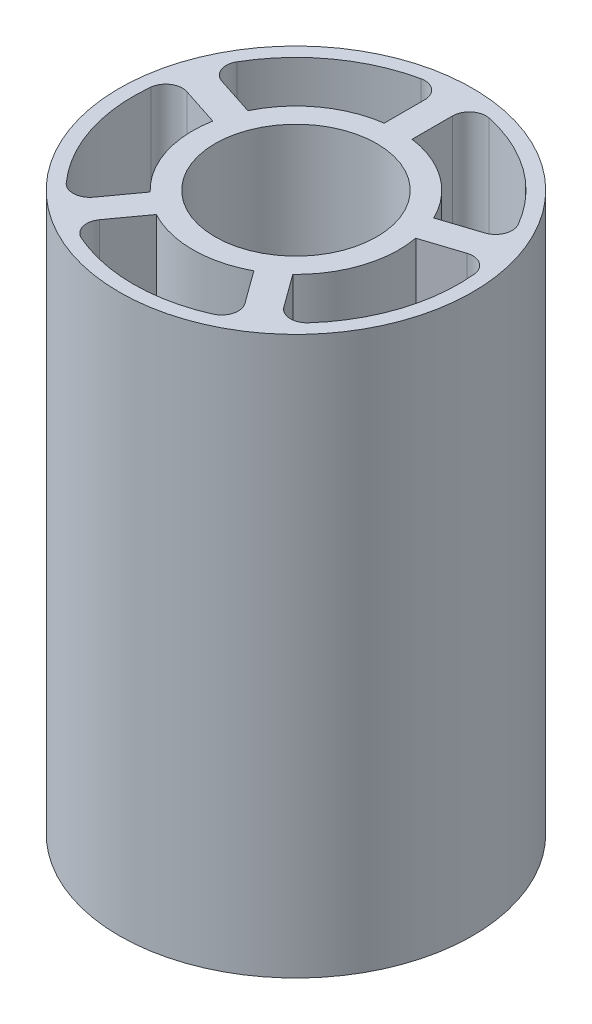
from build123d import *

# Parameters (mm, degrees)
SKETCH1_R           = 31.685
SKETCH1_R_2         = 14.5
BOSS_EXTRUDE1_DEPTH = 100


with BuildPart() as part:
    # Sketch1 → Boss-Extrude1 (new body)
    with BuildSketch(Plane(origin=(0, 0, 0), x_dir=(1, 0, 0), z_dir=(0, 1, 0))):
        with Locations(Location((0, 0, 0), (0, 0, 270))):
            Circle(SKETCH1_R)
        with Locations(Location((0, 0, 0), (0, 0, 270))):
            Circle(SKETCH1_R_2, mode=Mode.SUBTRACT)
        with BuildLine():
            Line((23.575325811, 10.288743262), (16.660611418, 8.042016362))
            ThreePointArc((16.660611418, 8.042016362), (10.874027167, 14.966814396), (2.5, 18.33030278))
            Line((2.5, 18.33030278), (2.5, 25.600863755))
            ThreePointArc((2.5, 25.600863755), (3.614581646, 27.93435848), (6.130131755, 28.53393961))
            ThreePointArc((6.130131755, 28.53393961), (17.154512588, 23.611160981), (25.243074312, 14.647574007))
            ThreePointArc((25.243074312, 14.647574007), (25.450186505, 12.069862926), (23.575325811, 10.288743262))
        make_face(mode=Mode.SUBTRACT)
        with BuildLine():
            Line((-2.5, 25.600863755), (-2.5, 18.33030278))
            ThreePointArc((-2.5, 18.33030278), (-10.874027167, 14.966814396), (-16.660611418, 8.042016362))
            Line((-16.660611418, 8.042016362), (-23.575325811, 10.288743262))
            ThreePointArc((-23.575325811, 10.288743262), (-25.450186505, 12.069862926), (-25.243074312, 14.647574007))
            ThreePointArc((-25.243074312, 14.647574007), (-17.154512588, 23.611160981), (-6.130131755, 28.53393961))
            ThreePointArc((-6.130131755, 28.53393961), (-3.614581646, 27.93435848), (-2.5, 25.600863755))
        make_face(mode=Mode.SUBTRACT)
        with BuildLine():
            Line((25.120410783, 5.53346068), (18.20569639, 3.28673378))
            ThreePointArc((18.20569639, 3.28673378), (17.594545551, -5.716814396), (12.79682413, -13.36006333))
            Line((12.79682413, -13.36006333), (17.070352647, -19.242070718))
            ThreePointArc((17.070352647, -19.242070718), (19.343661926, -20.474772952), (21.73120966, -19.481241021))
            ThreePointArc((21.73120966, -19.481241021), (27.756584428, -9.018660981), (29.031704092, 2.987370505))
            ThreePointArc((29.031704092, 2.987370505), (27.684120817, 5.194520069), (25.120410783, 5.53346068))
        make_face(mode=Mode.SUBTRACT)
        with BuildLine():
            Line((13.025267675, -22.180996979), (8.751739158, -16.298989592))
            ThreePointArc((8.751739158, -16.298989592), (0, -18.5), (-8.751739158, -16.298989592))
            Line((-8.751739158, -16.298989592), (-13.025267675, -22.180996979))
            ThreePointArc((-13.025267675, -22.180996979), (-13.495145967, -24.723968522), (-11.812448125, -26.687643101))
            ThreePointArc((-11.812448125, -26.687643101), (0, -29.185), (11.812448125, -26.687643101))
            ThreePointArc((11.812448125, -26.687643101), (13.495145967, -24.723968522), (13.025267675, -22.180996979))
        make_face(mode=Mode.SUBTRACT)
        with BuildLine():
            Line((-17.070352647, -19.242070718), (-12.79682413, -13.36006333))
            ThreePointArc((-12.79682413, -13.36006333), (-17.594545551, -5.716814396), (-18.20569639, 3.28673378))
            Line((-18.20569639, 3.28673378), (-25.120410783, 5.53346068))
            ThreePointArc((-25.120410783, 5.53346068), (-27.684120817, 5.194520069), (-29.031704092, 2.987370505))
            ThreePointArc((-29.031704092, 2.987370505), (-27.756584428, -9.018660981), (-21.73120966, -19.481241021))
            ThreePointArc((-21.73120966, -19.481241021), (-19.343661926, -20.474772952), (-17.070352647, -19.242070718))
        make_face(mode=Mode.SUBTRACT)
    extrude(amount=BOSS_EXTRUDE1_DEPTH)


solid = part.part
